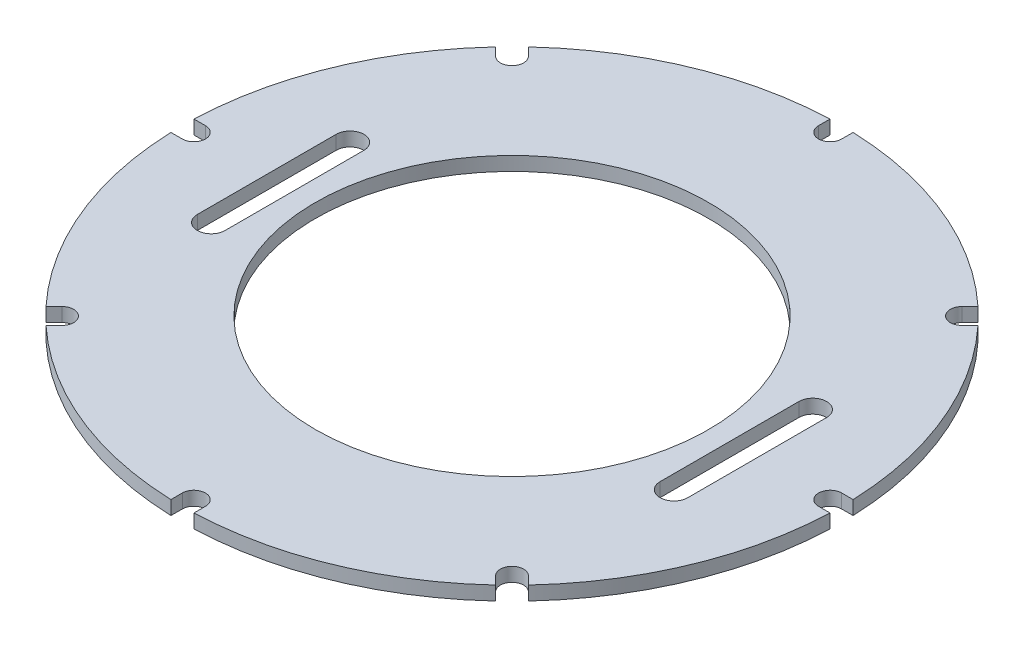
from build123d import *

# Parameters (mm, degrees)
SKETCH1_R           = 8.5
BOSS_EXTRUDE1_DEPTH = 0.6


with BuildPart() as part:
    # Sketch1 → Boss-Extrude1 (new body)
    with BuildSketch(Plane(origin=(0, 0, 0), x_dir=(1, 0, 0), z_dir=(0, 1, 0))):
        with BuildLine():
            Line((-0.5, -14.241225369), (-0.5, -13.75))
            ThreePointArc((-0.5, -13.75), (0, -13.25), (0.5, -13.75))
            Line((0.5, -13.75), (0.5, -14.241225369))
            ThreePointArc((0.5, -14.241225369), (5.453238911, -13.165283338), (9.71651364, -10.423620421))
            Line((9.71651364, -10.423620421), (9.369164851, -10.076271632))
            ThreePointArc((9.369164851, -10.076271632), (9.369164851, -9.369164851), (10.076271632, -9.369164851))
            Line((10.076271632, -9.369164851), (10.423620421, -9.71651364))
            ThreePointArc((10.423620421, -9.71651364), (13.165283338, -5.453238911), (14.241225369, -0.5))
            Line((14.241225369, -0.5), (13.75, -0.5))
            ThreePointArc((13.75, -0.5), (13.25, 0), (13.75, 0.5))
            Line((13.75, 0.5), (14.241225369, 0.5))
            ThreePointArc((14.241225369, 0.5), (13.165283338, 5.453238911), (10.423620421, 9.71651364))
            Line((10.423620421, 9.71651364), (10.076271632, 9.369164851))
            ThreePointArc((10.076271632, 9.369164851), (9.369164851, 9.369164851), (9.369164851, 10.076271632))
            Line((9.369164851, 10.076271632), (9.71651364, 10.423620421))
            ThreePointArc((9.71651364, 10.423620421), (5.453238911, 13.165283338), (0.5, 14.241225369))
            Line((0.5, 14.241225369), (0.5, 13.75))
            ThreePointArc((0.5, 13.75), (0, 13.25), (-0.5, 13.75))
            Line((-0.5, 13.75), (-0.5, 14.241225369))
            ThreePointArc((-0.5, 14.241225369), (-5.453238911, 13.165283338), (-9.71651364, 10.423620421))
            Line((-9.71651364, 10.423620421), (-9.369164851, 10.076271632))
            ThreePointArc((-9.369164851, 10.076271632), (-9.369164851, 9.369164851), (-10.076271632, 9.369164851))
            Line((-10.076271632, 9.369164851), (-10.423620421, 9.71651364))
            ThreePointArc((-10.423620421, 9.71651364), (-13.165283338, 5.453238911), (-14.241225369, 0.5))
            Line((-14.241225369, 0.5), (-13.75, 0.5))
            ThreePointArc((-13.75, 0.5), (-13.25, 0), (-13.75, -0.5))
            Line((-13.75, -0.5), (-14.241225369, -0.5))
            ThreePointArc((-14.241225369, -0.5), (-13.165283338, -5.453238911), (-10.423620421, -9.71651364))
            Line((-10.423620421, -9.71651364), (-10.076271632, -9.369164851))
            ThreePointArc((-10.076271632, -9.369164851), (-9.369164851, -9.369164851), (-9.369164851, -10.076271632))
            Line((-9.369164851, -10.076271632), (-9.71651364, -10.423620421))
            ThreePointArc((-9.71651364, -10.423620421), (-5.453238911, -13.165283338), (-0.5, -14.241225369))
        make_face()
        with BuildLine():
            Line((-9.4, 3), (-9.4, -3))
            ThreePointArc((-9.4, -3), (-10, -3.6), (-10.6, -3))
            Line((-10.6, -3), (-10.6, 3))
            ThreePointArc((-10.6, 3), (-10, 3.6), (-9.4, 3))
        make_face(mode=Mode.SUBTRACT)
        with Locations(Location((0, 0, 0), (0, 0, 270))):
            Circle(SKETCH1_R, mode=Mode.SUBTRACT)
        with BuildLine():
            ThreePointArc((10.6, -3), (10, -3.6), (9.4, -3))
            Line((9.4, -3), (9.4, 3))
            ThreePointArc((9.4, 3), (10, 3.6), (10.6, 3))
            Line((10.6, 3), (10.6, -3))
        make_face(mode=Mode.SUBTRACT)
    extrude(amount=BOSS_EXTRUDE1_DEPTH)


solid = part.part
